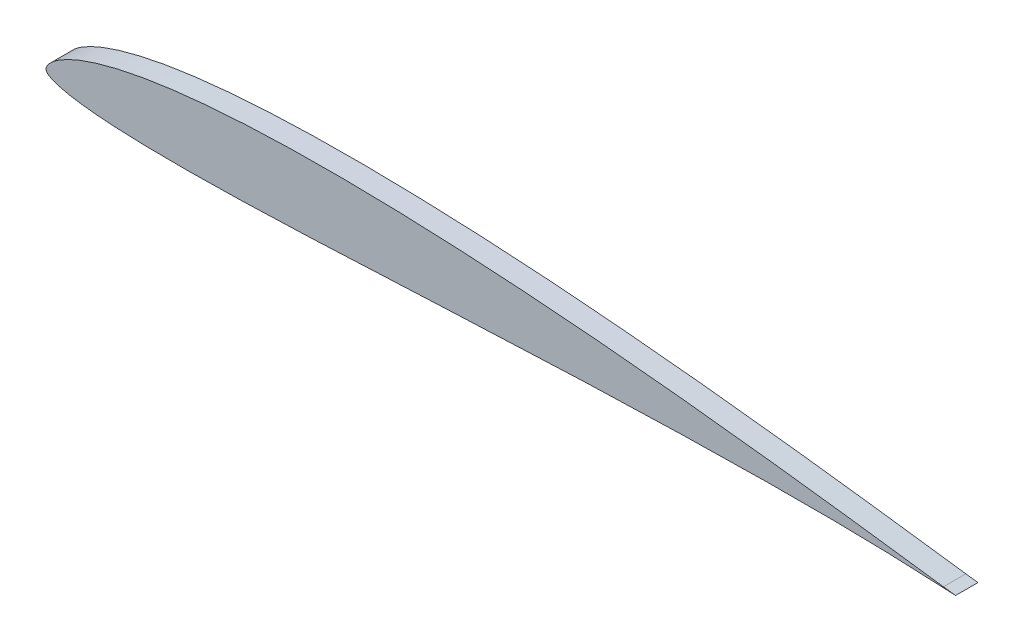
from build123d import *

# Parameters (mm, degrees)
BOSS_EXTRUDE2_DEPTH = 5.08


with BuildPart() as part:
    # Sketch2 → Boss-Extrude2 (new body)
    with BuildSketch(Plane.XY):
        with BuildLine():
            Line((203.2, -0.100617268), (205.950245436, -0.437968258))
            Line((205.950245436, -0.437968258), (203.2, -0.296293406))
            add(Edge.make_bspline(
                [(203.2, -0.100617268), (202.797203817, -0.051209427), (201.580451916, 0.098039965), (199.447976907, 0.384512585), (196.779753526, 0.739681963), (193.985109849, 1.118950273), (191.16741732, 1.498497579), (188.346823799, 1.876163722), (185.525409831, 2.248322432), (182.703701905, 2.61673136), (179.881561948, 2.979885412), (177.05961195, 3.338788055), (174.23752411, 3.692795647), (170.475518901, 4.159977197), (166.712715756, 4.618149249), (162.949590214, 5.066734031), (160.127061411, 5.398423446), (157.304169873, 5.72410874), (154.48083502, 6.045169627), (151.656904616, 6.360149323), (148.83234404, 6.669110254), (146.007360314, 6.97258671), (143.182003448, 7.26965221), (140.356401757, 7.560542119), (137.530435233, 7.844546145), (134.704500587, 8.121839038), (131.87841146, 8.391575651), (129.052105194, 8.653448025), (126.225681336, 8.907537794), (123.399293268, 9.153142433), (120.572870302, 9.390806918), (116.804935383, 9.696008309), (113.036553758, 9.984070477), (109.267987351, 10.253628254), (105.500928308, 10.510869864), (101.73364578, 10.747974197), (97.96656786, 10.965513499), (95.142141925, 11.117623122), (92.318344994, 11.25922411), (89.495212967, 11.389445435), (86.672766686, 11.508274421), (82.911487125, 11.650224262), (78.212563447, 11.796880832), (73.514706789, 11.898110877), (69.759528238, 11.950279028), (66.945851773, 11.973163736), (64.134134457, 11.980315448), (61.324783103, 11.969099992), (58.518120393, 11.941040492), (55.714367643, 11.892641831), (52.913910347, 11.824125753), (49.187207976, 11.703383045), (45.467732836, 11.536088472), (41.757039408, 11.315286825), (38.983448291, 11.121339332), (36.218778962, 10.896171418), (33.46431262, 10.638363698), (30.722701324, 10.343012458), (27.996113045, 10.009567115), (25.287794405, 9.632190848), (22.602521985, 9.207390847), (19.944833868, 8.729976322), (17.323740678, 8.19362692), (14.747775243, 7.592006209), (12.232831475, 6.918050262), (9.802225578, 6.164351513), (7.5013093, 5.33006385), (5.415171331, 4.430639063), (3.664558555, 3.51646707), (2.33735513, 2.664816011), (1.425096234, 1.93915994), (0.82798105, 1.355422378), (0.441274328, 0.880143343), (0.190793496, 0.48090793), (0.04048893, 0.131446639), (-0.014028535, -0.198072905), (0.055784161, -0.522646744), (0.2678972, -0.825744248), (0.614779541, -1.109175986), (1.118802319, -1.402914178), (1.861797987, -1.726584199), (2.970051593, -2.093818128), (4.543373891, -2.483169232), (6.568252229, -2.857130131), (8.922230283, -3.175979061), (11.459092353, -3.436246409), (14.088847751, -3.638243858), (16.7692515, -3.790533848), (19.481988639, -3.902679958), (22.217324817, -3.981081671), (24.968869523, -4.032166831), (27.733036207, -4.058501582), (30.506778746, -4.063894936), (33.288562868, -4.051141344), (36.076625687, -4.021037542), (38.87002219, -3.976162538), (41.667754286, -3.918743839), (44.469336179, -3.849423636), (47.274164406, -3.769613863), (50.082029678, -3.680311573), (52.892550684, -3.583218305), (55.705818, -3.478201236), (58.521736219, -3.367466256), (61.340384065, -3.252118161), (64.161651978, -3.131814828), (66.985574885, -3.00785734), (69.812118227, -2.880202092), (72.641396932, -2.750429844), (75.473158429, -2.618132198), (79.252996017, -2.440075678), (83.033804293, -2.260049585), (86.813865444, -2.079645925), (89.646195991, -1.945232344), (92.476526576, -1.811007122), (95.304993023, -1.67881477), (98.131621147, -1.548241267), (100.956506332, -1.419960753), (103.780336269, -1.293032624), (106.603321892, -1.169408704), (109.425419655, -1.048464429), (112.246433738, -0.930431945), (115.066818042, -0.815131894), (117.886361111, -0.7042612), (120.705124685, -0.596293965), (123.522827525, -0.492777088), (126.339771365, -0.39306504), (130.093763619, -0.266371517), (133.846963358, -0.148319067), (137.599595703, -0.040354383), (140.413697464, 0.036224668), (143.227815753, 0.10736369), (146.980533752, 0.196449437), (150.733888428, 0.274956546), (154.487963163, 0.343763848), (157.304049112, 0.388107894), (160.12079266, 0.427324226), (162.938428456, 0.459012796), (165.756944663, 0.483220321), (168.576075909, 0.498535298), (171.395749828, 0.505727249), (174.215970767, 0.501872707), (177.03673859, 0.488150248), (179.857921635, 0.462760491), (182.679519705, 0.424417507), (185.501374927, 0.371545664), (188.323332206, 0.305598234), (191.145402374, 0.223586019), (193.965637727, 0.1262976), (196.767087138, 0.01458454), (199.441721084, -0.104336826), (201.58020397, -0.212851993), (202.796999818, -0.275533443), (203.2, -0.296293406)],
                knots=[0, 0, 0, 0, 0.002964117, 0.008953895, 0.015715555, 0.02262519, 0.029553456, 0.036482271, 0.043411058, 0.050339966, 0.057267347, 0.064194328, 0.07111792, 0.078041821, 0.091883618, 0.098804929, 0.105722821, 0.112641625, 0.119560497, 0.126477763, 0.133395912, 0.140314536, 0.147230556, 0.154146465, 0.161062198, 0.167975778, 0.174886609, 0.181798143, 0.188707924, 0.195614441, 0.202520257, 0.209425351, 0.223226073, 0.230125214, 0.237021781, 0.250805241, 0.257696252, 0.264582839, 0.2714651, 0.278347536, 0.285225271, 0.292098857, 0.305839934, 0.319563209, 0.326420188, 0.333270807, 0.34011528, 0.346957313, 0.353790744, 0.360616425, 0.367439194, 0.374251619, 0.387850774, 0.394633045, 0.401402552, 0.408158543, 0.414892998, 0.421608923, 0.428298863, 0.434955971, 0.44158095, 0.448155139, 0.45467718, 0.46112035, 0.46747387, 0.473690893, 0.479702211, 0.485342584, 0.49027189, 0.49411113, 0.496842211, 0.498771831, 0.500198868, 0.501307655, 0.502204472, 0.50296261, 0.503708984, 0.504565751, 0.505610252, 0.506960117, 0.508815616, 0.511519486, 0.515478383, 0.520644271, 0.526552428, 0.532824474, 0.539268844, 0.545815427, 0.552433143, 0.559099351, 0.565802504, 0.572533989, 0.579289903, 0.586062197, 0.592852616, 0.599655387, 0.606468124, 0.613291894, 0.620124754, 0.626963242, 0.633811286, 0.640665424, 0.647526043, 0.654395046, 0.661270456, 0.668151708, 0.675041242, 0.681936977, 0.688838893, 0.695747395, 0.70957607, 0.716485748, 0.723388931, 0.730287103, 0.737182123, 0.744071007, 0.750955217, 0.757836754, 0.764717491, 0.771594468, 0.77846868, 0.785340609, 0.792212162, 0.799078939, 0.805944356, 0.812806945, 0.819667181, 0.833379655, 0.840234373, 0.847088277, 0.853941858, 0.860795654, 0.87450638, 0.881362852, 0.888220537, 0.895078011, 0.90193873, 0.908802231, 0.915665588, 0.922530345, 0.929397562, 0.936264858, 0.943133836, 0.950004659, 0.956876033, 0.963748612, 0.970622178, 0.977497432, 0.984360165, 0.99110056, 0.997052525, 1, 1, 1, 1], degree=3))
        make_face()
    extrude(amount=BOSS_EXTRUDE2_DEPTH)


solid = part.part
